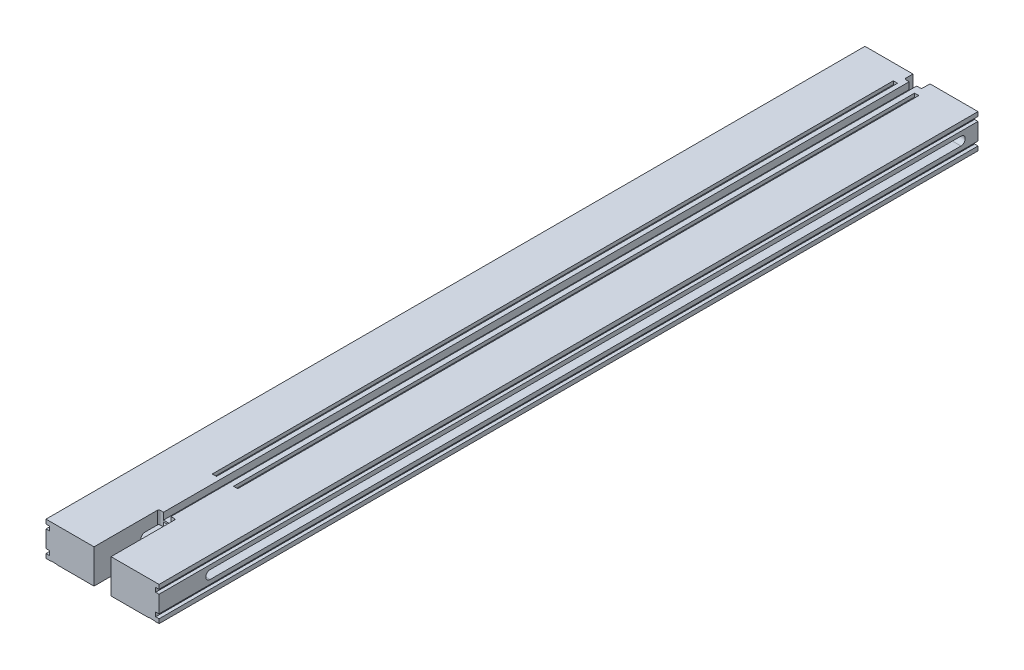
from build123d import *

# Parameters (mm, degrees)
BOSS_EXTRUDE1_DEPTH      = 584.2
BOSS_EXTRUDE1_DEPTH_BACK = 1.27
CUT_EXTRUDE1_DEPTH       = 19.05
SKETCH3_W                = 585.47
SKETCH3_H                = 3.175
CUT_EXTRUDE2_DEPTH       = 2.54
SKETCH4_W                = 585.47
SKETCH4_H                = 3.175
CUT_EXTRUDE3_DEPTH       = 2.54
SKETCH5_W                = 585.47
SKETCH5_H                = 3.175
CUT_EXTRUDE4_DEPTH       = 2.54
SKETCH6_W                = 585.47
SKETCH6_H                = 3.175
CUT_EXTRUDE5_DEPTH       = 2.54
CUT_EXTRUDE6_DEPTH       = 591.801160784
CUT_EXTRUDE8_DEPTH       = 591.667532064
FILLET4_R                = 1.016
CUT_EXTRUDE9_DEPTH       = 591.667532064
FILLET5_R                = 1.016
SKETCH12_W               = 3.175
SKETCH12_H               = 508
CUT_EXTRUDE10_DEPTH      = 2.54
BOSS_EXTRUDE3_DEPTH      = 25.4
SKETCH13_W               = 5.588
SKETCH13_H               = 635
CUT_EXTRUDE11_DEPTH      = 5.08


with BuildPart() as part:
    # Sketch1 → Boss-Extrude1 (new, two sides: drawn at the far end of the back side and taken through both)
    with BuildSketch(Plane.XY.offset(-BOSS_EXTRUDE1_DEPTH_BACK)):
        Polygon((83.386650215, 0), (80.211650215, 0), (80.211650215, 0.254), (75.385650215, 0.254), (75.385650215, 0), (7.059650215, 0), (7.059650215, 0.254), (2.233650215, 0.254), (2.233650215, 0), (-0.941349785, 0), (-0.941349785, 25.4), (83.386650215, 25.4), align=None)
    extrude(amount=BOSS_EXTRUDE1_DEPTH + BOSS_EXTRUDE1_DEPTH_BACK)

    # Sketch2 → Cut-Extrude1 (cut)
    with BuildSketch(Plane.XZ):
        with BuildLine():
            Line((34.872650215, 27.305), (34.872650215, 555.625))
            ThreePointArc((34.872650215, 555.625), (41.222650215, 561.975), (47.572650215, 555.625))
            Line((47.572650215, 555.625), (47.572650215, 27.305))
            ThreePointArc((47.572650215, 27.305), (41.222650215, 20.955), (34.872650215, 27.305))
        make_face()
    extrude(amount=-CUT_EXTRUDE1_DEPTH, mode=Mode.SUBTRACT)

    # Sketch3 → Cut-Extrude2 (cut)
    with BuildSketch(Plane(origin=(83.386650215, 0, 0), x_dir=(0, 0, -1), z_dir=(1, 0, 0))):
        with Locations((-291.465, 20.6375)):
            Rectangle(SKETCH3_W, SKETCH3_H)
    extrude(amount=-CUT_EXTRUDE2_DEPTH, mode=Mode.SUBTRACT)

    # Sketch4 → Cut-Extrude3 (cut)
    with BuildSketch(Plane(origin=(83.386650215, 0, 0), x_dir=(0, 0, -1), z_dir=(1, 0, 0))):
        with Locations((-291.465, 4.7625)):
            Rectangle(SKETCH4_W, SKETCH4_H)
    extrude(amount=-CUT_EXTRUDE3_DEPTH, mode=Mode.SUBTRACT)

    # Sketch5 → Cut-Extrude4 (cut)
    with BuildSketch(Plane.ZY.offset(0.941349785)):
        with Locations((291.465, 4.7625)):
            Rectangle(SKETCH5_W, SKETCH5_H)
    extrude(amount=-CUT_EXTRUDE4_DEPTH, mode=Mode.SUBTRACT)

    # Sketch6 → Cut-Extrude5 (cut)
    with BuildSketch(Plane.ZY.offset(0.941349785)):
        with Locations((291.465, 20.6375)):
            Rectangle(SKETCH6_W, SKETCH6_H)
    extrude(amount=-CUT_EXTRUDE5_DEPTH, mode=Mode.SUBTRACT)

    # Sketch7 → Cut-Extrude6 (cut, through all)
    with BuildSketch(Plane(origin=(83.386650215, 0, 0), x_dir=(0, 0, -1), z_dir=(1, 0, 0))):
        with BuildLine():
            Line((-11.43, 9.5123), (-571.5, 9.5123))
            ThreePointArc((-571.5, 9.5123), (-574.6877, 12.7), (-571.5, 15.8877))
            Line((-571.5, 15.8877), (-11.43, 15.8877))
            ThreePointArc((-11.43, 15.8877), (-8.2423, 12.7), (-11.43, 9.5123))
        make_face()
    extrude(amount=-CUT_EXTRUDE6_DEPTH, mode=Mode.SUBTRACT)

    # Sketch10 → Cut-Extrude8 (cut, through all)
    with BuildSketch(Plane(origin=(0, 25.4, 0), x_dir=(1, 0, 0), z_dir=(0, 1, 0))):
        Polygon((41.222650215, -584.2), (47.572650215, -584.2), (47.572650215, -561.34), (34.872650215, -561.34), (34.872650215, -584.2), align=None)
    extrude(amount=-CUT_EXTRUDE8_DEPTH, mode=Mode.SUBTRACT)

    # Fillet4
    fillet4_edges = [part.edges().sort_by_distance(p)[0] for p in [
        (47.572650215, 20.64385, 561.34),
        (34.872650215, 20.64385, 561.34),
    ]]
    fillet(fillet4_edges, radius=FILLET4_R)

    # Sketch9 → Cut-Extrude9 (cut, through all)
    with BuildSketch(Plane.XZ):
        Polygon((47.572650215, -1.27), (34.872650215, -1.27), (34.872650215, 5.08), (41.222650215, 5.08), (47.572650215, 5.08), align=None)
    extrude(amount=-CUT_EXTRUDE9_DEPTH, mode=Mode.SUBTRACT)

    # Fillet5
    fillet5_edges = [part.edges().sort_by_distance(p)[0] for p in [
        (47.572650215, 12.7, 5.08),
        (34.872650215, 12.7, 5.08),
    ]]
    fillet(fillet5_edges, radius=FILLET5_R)

    # Sketch12 → Cut-Extrude10 (cut)
    with BuildSketch(Plane(origin=(0, 25.4, 0), x_dir=(1, 0, 0), z_dir=(0, 1, 0))):
        with Locations((33.505889839, -264.440775348)):
            Rectangle(SKETCH12_W, SKETCH12_H)
        Polygon((47.793389839, -10.440775348), (47.793389839, -13.508701224), (47.793389839, -20.346727485), (47.793389839, -518.440775348), (50.968389839, -518.440775348), (50.968389839, -10.440775348), align=None)
    extrude(amount=-CUT_EXTRUDE10_DEPTH, mode=Mode.SUBTRACT)

    # Sketch15 → Boss-Extrude3 (add)
    with BuildSketch(Plane.XY.offset(584.2)):
        Polygon((-0.941349785, 25.4), (34.872650215, 25.4), (34.872650215, 0), (7.059650215, 0), (7.059650215, 0.254), (2.233650215, 0.254), (2.233650215, 0), (-0.941349785, 0), (-0.941349785, 3.175), (1.598650215, 3.175), (1.598650215, 6.35), (-0.941349785, 6.35), (-0.941349785, 19.05), (1.598650215, 19.05), (1.598650215, 22.225), (-0.941349785, 22.225), align=None)
        Polygon((47.572650215, 0), (47.572650215, 25.4), (83.386650215, 25.4), (83.386650215, 22.225), (80.846650215, 22.225), (80.846650215, 19.05), (83.386650215, 19.05), (83.386650215, 6.35), (80.846650215, 6.35), (80.846650215, 3.175), (83.386650215, 3.175), (83.386650215, 0), (80.211650215, 0), (80.211650215, 0.254), (75.385650215, 0.254), (75.385650215, 0), align=None)
    extrude(amount=BOSS_EXTRUDE3_DEPTH)

    # Sketch13 → Cut-Extrude11 (cut)
    with BuildSketch(Plane(origin=(0, 25.4, 0), x_dir=(1, 0, 0), z_dir=(0, 1, 0))):
        with Locations((41.222650215, -302.540775348)):
            Rectangle(SKETCH13_W, SKETCH13_H)
    extrude(amount=-CUT_EXTRUDE11_DEPTH, mode=Mode.SUBTRACT)


solid = part.part
